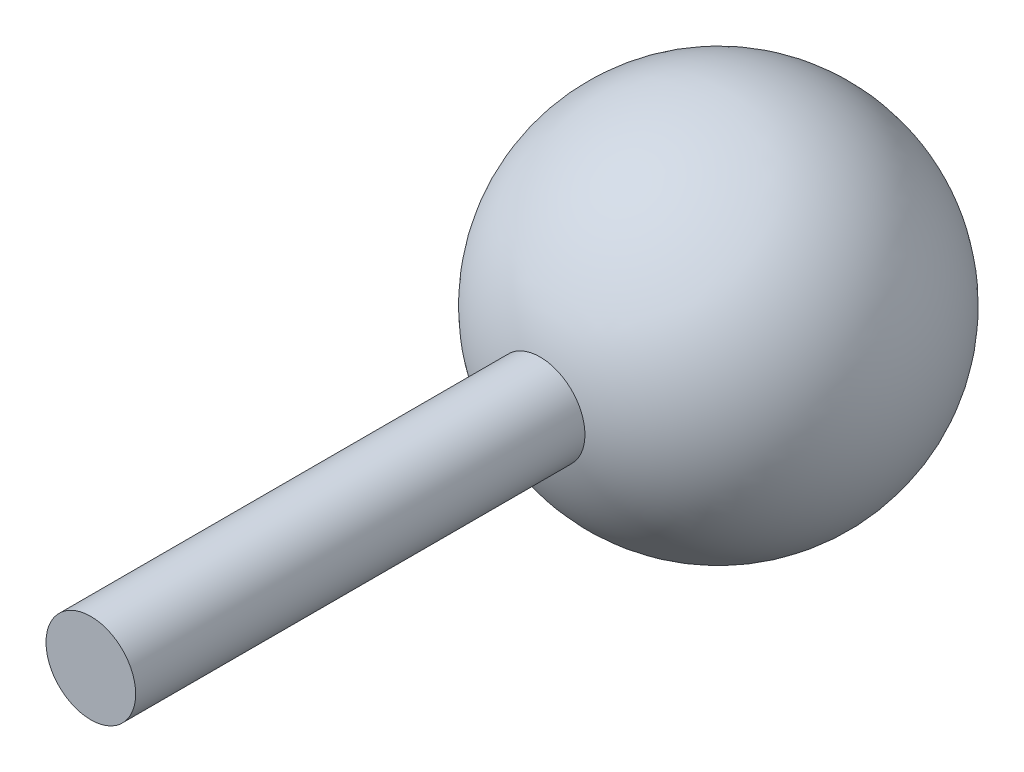
from build123d import *

# Parameters (mm, degrees)
SKETCH4_R           = 10
BOSS_EXTRUDE1_DEPTH = 140


with BuildPart() as part:
    # Sketch2 → Revolve5 (revolve)
    with BuildSketch(Plane.XY):
        with BuildLine():
            Line((0, 41), (0, -41))
            ThreePointArc((0, -41), (-41, 0), (0, 41))
        make_face()
    revolve(axis=Axis((0, 90.069891633, 0), (0, -1, 0)))

    # Sketch4 → Boss-Extrude1 (add)
    with BuildSketch(Plane.XY):
        with Locations(Location((0, 0, 0), (0, 0, 180))):
            Circle(SKETCH4_R)
    extrude(amount=BOSS_EXTRUDE1_DEPTH)


solid = part.part
